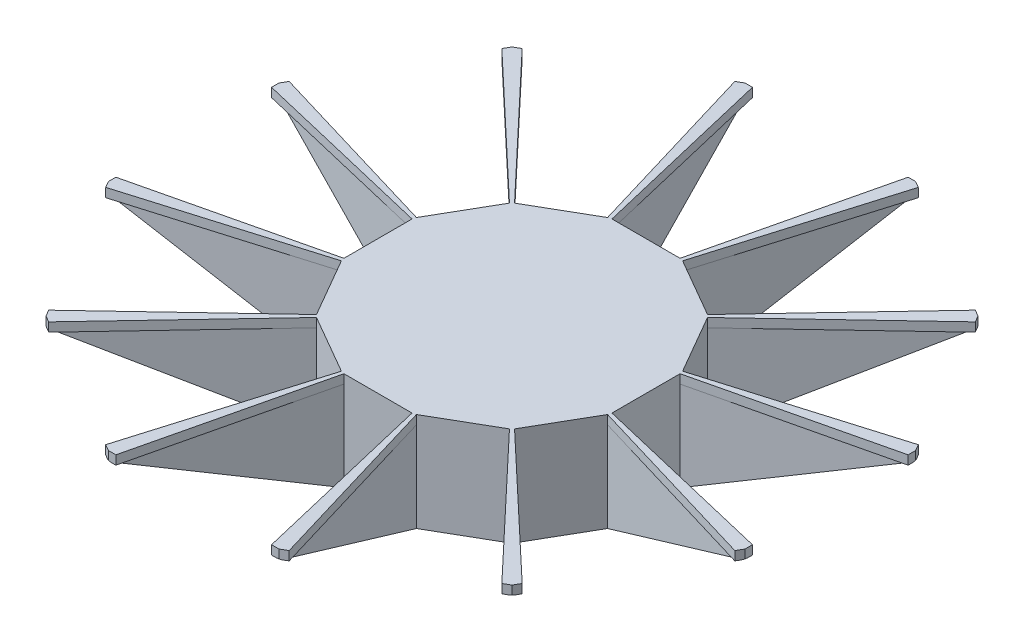
from build123d import *

# Parameters (mm, degrees)
BOSS_EXTRUDE1_DEPTH = 5
BOSS_EXTRUDE2_DEPTH = 50
CUT_EXTRUDE2_REACH  = 258.619
CIRPATTERN1_COUNT   = 12


with BuildPart() as part:
    # Sketch1 → Boss-Extrude1 (new body)
    with BuildSketch(Plane(origin=(0, 0, 0), x_dir=(1, 0, 0), z_dir=(0, 1, 0))):
        Polygon((-51.086301889, 175.201860999), (-20.896575472, 74.123378061), (-53.744440679, 55.158654242), (-126.186111471, 131.84296572), (-129.77241336, 129.77241336), (-131.84296572, 126.186111471), (-55.158654242, 53.744440679), (-74.123378061, 20.896575472), (-175.201860999, 51.086301889), (-177.27241336, 47.5), (-177.27241336, 43.358895278), (-74.641016151, 18.96472382), (-74.641016151, -18.96472382), (-177.27241336, -43.358895278), (-177.27241336, -47.5), (-175.201860999, -51.086301889), (-74.123378061, -20.896575472), (-55.158654242, -53.744440679), (-131.84296572, -126.186111471), (-129.77241336, -129.77241336), (-126.186111471, -131.84296572), (-53.744440679, -55.158654242), (-20.896575472, -74.123378061), (-51.086301889, -175.201860999), (-47.5, -177.27241336), (-43.358895278, -177.27241336), (-18.96472382, -74.641016151), (18.96472382, -74.641016151), (43.358895278, -177.27241336), (47.5, -177.27241336), (51.086301889, -175.201860999), (20.896575472, -74.123378061), (53.744440679, -55.158654242), (126.186111471, -131.84296572), (129.77241336, -129.77241336), (131.84296572, -126.186111471), (55.158654242, -53.744440679), (74.123378061, -20.896575472), (175.201860999, -51.086301889), (177.27241336, -47.5), (177.27241336, -43.358895278), (74.641016151, -18.96472382), (74.641016151, 18.96472382), (177.27241336, 43.358895278), (177.27241336, 47.5), (175.201860999, 51.086301889), (74.123378061, 20.896575472), (55.158654242, 53.744440679), (131.84296572, 126.186111471), (129.77241336, 129.77241336), (126.186111471, 131.84296572), (53.744440679, 55.158654242), (20.896575472, 74.123378061), (51.086301889, 175.201860999), (47.5, 177.27241336), (43.358895278, 177.27241336), (18.96472382, 74.641016151), (-18.96472382, 74.641016151), (-43.358895278, 177.27241336), (-47.5, 177.27241336), align=None)
    extrude(amount=BOSS_EXTRUDE1_DEPTH)

    # Sketch2 → Boss-Extrude2 (add)
    with BuildSketch(Plane.XZ):
        Polygon((-20.896575472, 74.123378061), (-48.396575472, 176.754775269), (-47.5, 177.27241336), (-46.46472382, 177.27241336), (-18.96472382, 74.641016151), (18.96472382, 74.641016151), (46.46472382, 177.27241336), (47.5, 177.27241336), (48.396575472, 176.754775269), (20.896575472, 74.123378061), (53.744440679, 55.158654242), (128.875837887, 130.29005145), (129.77241336, 129.77241336), (130.29005145, 128.875837887), (55.158654242, 53.744440679), (74.123378061, 20.896575472), (176.754775269, 48.396575472), (177.27241336, 47.5), (177.27241336, 46.46472382), (74.641016151, 18.96472382), (74.641016151, -18.96472382), (177.27241336, -46.46472382), (177.27241336, -47.5), (176.754775269, -48.396575472), (74.123378061, -20.896575472), (55.158654242, -53.744440679), (130.29005145, -128.875837887), (129.77241336, -129.77241336), (128.875837887, -130.29005145), (53.744440679, -55.158654242), (20.896575472, -74.123378061), (48.396575472, -176.754775269), (47.5, -177.27241336), (46.46472382, -177.27241336), (18.96472382, -74.641016151), (-18.96472382, -74.641016151), (-46.46472382, -177.27241336), (-47.5, -177.27241336), (-48.396575472, -176.754775269), (-20.896575472, -74.123378061), (-53.744440679, -55.158654242), (-128.875837887, -130.29005145), (-129.77241336, -129.77241336), (-130.29005145, -128.875837887), (-55.158654242, -53.744440679), (-74.123378061, -20.896575472), (-176.754775269, -48.396575472), (-177.27241336, -47.5), (-177.27241336, -46.46472382), (-74.641016151, -18.96472382), (-74.641016151, 18.96472382), (-177.27241336, 46.46472382), (-177.27241336, 47.5), (-176.754775269, 48.396575472), (-74.123378061, 20.896575472), (-55.158654242, 53.744440679), (-130.29005145, 128.875837887), (-129.77241336, 129.77241336), (-128.875837887, 130.29005145), (-53.744440679, 55.158654242), align=None)
        Polygon((-19.330127019, 72.141016151), (-52.810889132, 52.810889132), (-72.141016151, 19.330127019), (-72.141016151, -19.330127019), (-52.810889132, -52.810889132), (-19.330127019, -72.141016151), (19.330127019, -72.141016151), (52.810889132, -52.810889132), (72.141016151, -19.330127019), (72.141016151, 19.330127019), (52.810889132, 52.810889132), (19.330127019, 72.141016151), align=None, mode=Mode.SUBTRACT)
    extrude(amount=BOSS_EXTRUDE2_DEPTH)

    # Sketch4 → Cut-Extrude2 (cut, up to next)
    with BuildSketch(Plane(origin=(0.7071067811855712, 0, 0.7071067811855722), x_dir=(0.7071067811865479, 0, -0.7071067811865471), z_dir=(0.7071067811865471, 0, 0.7071067811865479)), mode=Mode.PRIVATE) as cut_extrude2_sk1:
        Polygon((-77.006116911, -50), (-183.136497491, 0), (-183.257957802, 0), (-183.257957802, -50), align=None)
    cut_extrude2_tool1 = extrude(cut_extrude2_sk1.sketch, amount=-CUT_EXTRUDE2_REACH, mode=Mode.PRIVATE) & part.part
    # Sketch4 → Cut-Extrude2 (cut, up to next)
    with BuildSketch(Plane(origin=(0.7071067811855712, 0, 0.7071067811855722), x_dir=(0.7071067811865479, 0, -0.7071067811865471), z_dir=(0.7071067811865471, 0, 0.7071067811865479)), mode=Mode.PRIVATE) as cut_extrude2_sk2:
        Polygon((-183.136497491, 0), (-185.006116911, 0.880812549), (-185.006116911, -50), (-183.257957802, -50), (-183.257957802, 0), align=None)
    cut_extrude2_tool2 = extrude(cut_extrude2_sk2.sketch, amount=-CUT_EXTRUDE2_REACH, mode=Mode.PRIVATE) & part.part
    cut_extrude2_1 = cut_extrude2_tool1.solids().sort_by_distance((-103.832006, -33.314303, 105.24622))[0]
    add(cut_extrude2_1, mode=Mode.SUBTRACT)
    cut_extrude2_2 = cut_extrude2_tool2.solids().sort_by_distance((-129.495561, -24.763955, 130.909775))[0]
    add(cut_extrude2_2, mode=Mode.SUBTRACT)
    cut_extrude2 = cut_extrude2_1 + cut_extrude2_2  # Cut-Extrude2 as one shape, for the pattern or mirror that repeats it

    # CirPattern1: Cut-Extrude2 ×12 about axis
    cirpattern1_axis = Axis((0, 0, 0), (0, 1, 0))
    for i in range(1, CIRPATTERN1_COUNT):
        add(cut_extrude2.rotate(cirpattern1_axis, i * 360 / CIRPATTERN1_COUNT), mode=Mode.SUBTRACT)


solid = part.part
